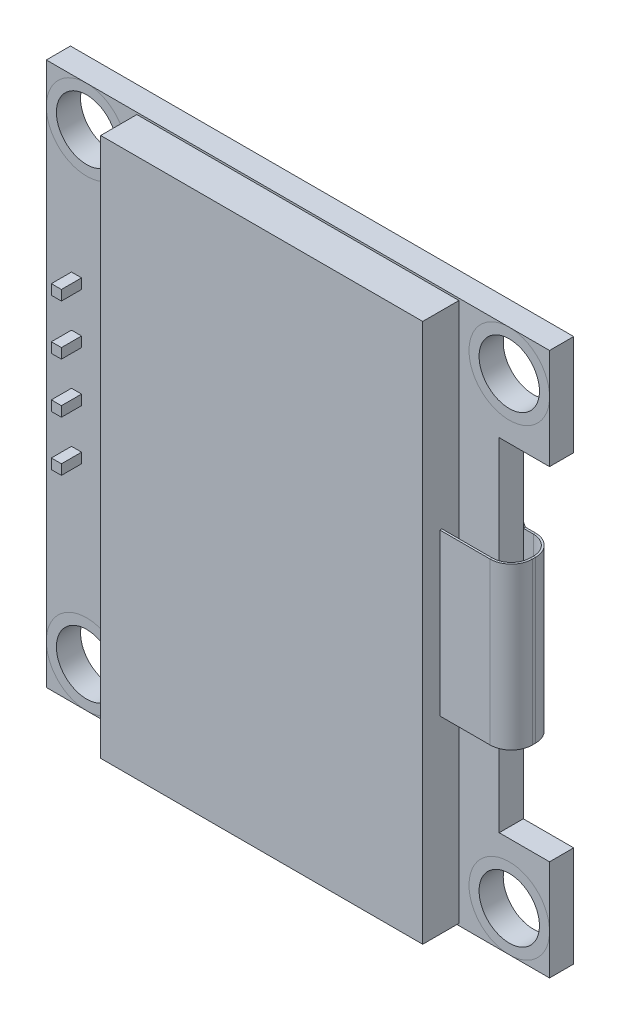
from build123d import *

# Parameters (mm, degrees)
BOSS_EXTRUDE1_DEPTH      = 1.2
SKETCH2_R                = 1.5
CUT_EXTRUDE1_DEPTH       = 19.437461864
BOSS_EXTRUDE2_DEPTH      = 2.5
BOSS_EXTRUDE3_DEPTH      = 5.5
BOSS_EXTRUDE3_DEPTH_BACK = 4.7
SKETCH6_W                = 0.5
SKETCH6_H                = 0.5
SKETCH7_W                = 16
SKETCH7_H                = 26.8
BOSS_EXTRUDE4_DEPTH      = 1.8
SKETCH8_W                = 1.5
SKETCH8_H                = 0.75
SKETCH8_W_2              = 0.75
SKETCH8_H_2              = 1.5
BOSS_EXTRUDE5_DEPTH      = 0.8
SKETCH10_W               = 0.1
SKETCH10_H               = 8
BOSS_EXTRUDE6_DEPTH      = 0.1
SKETCH12_W               = 1
SKETCH12_H               = 22.2
BOSS_EXTRUDE7_DEPTH      = 0.06


with BuildPart() as part:
    # Sketch1 → Boss-Extrude1 (new body)
    with BuildSketch(Plane.XY):
        Polygon((10, -8.5), (10, 8.5), (12.5, 8.5), (12.5, 13.5), (-12.5, 13.5), (-12.5, -13.5), (12.5, -13.5), (12.5, -8.5), align=None)
    extrude(amount=BOSS_EXTRUDE1_DEPTH)

    # Sketch2 → Cut-Extrude1 (cut, through all)
    with BuildSketch(Plane.XY.offset(1.2)):
        with Locations((10.5, 11.5)):
            Circle(SKETCH2_R)
        with Locations(Location((10.5, -11.5, 0), (0, 0, 180))):
            Circle(SKETCH2_R)
        with Locations(Location((-10.5, 11.5, 0), (0, 0, 180))):
            Circle(SKETCH2_R)
        with Locations((-10.5, -11.5)):
            Circle(SKETCH2_R)
    extrude(amount=-CUT_EXTRUDE1_DEPTH, mode=Mode.SUBTRACT)

    # Sketch5 → Boss-Extrude2 (add)
    with BuildSketch(Plane(origin=(0, 0, 0), x_dir=(-1, 0, 0), z_dir=(0, 0, -1))):
        with BuildLine():
            Line((12.05, 6), (9.95, 6))
            ThreePointArc((9.95, 6), (9.808578644, 5.941421356), (9.75, 5.8))
            Line((9.75, 5.8), (9.75, 3.7))
            ThreePointArc((9.75, 3.7), (9.808578644, 3.558578644), (9.95, 3.5))
            ThreePointArc((9.95, 3.5), (9.808578644, 3.441421356), (9.75, 3.3))
            Line((9.75, 3.3), (9.75, 1.2))
            ThreePointArc((9.75, 1.2), (9.808578644, 1.058578644), (9.95, 1))
            ThreePointArc((9.95, 1), (9.808578644, 0.941421356), (9.75, 0.8))
            Line((9.75, 0.8), (9.75, -1.3))
            ThreePointArc((9.75, -1.3), (9.808578644, -1.441421356), (9.95, -1.5))
            ThreePointArc((9.95, -1.5), (9.808578644, -1.558578644), (9.75, -1.7))
            Line((9.75, -1.7), (9.75, -3.8))
            ThreePointArc((9.75, -3.8), (9.808578644, -3.941421356), (9.95, -4))
            Line((9.95, -4), (12.05, -4))
            ThreePointArc((12.05, -4), (12.191421356, -3.941421356), (12.25, -3.8))
            Line((12.25, -3.8), (12.25, -1.7))
            ThreePointArc((12.25, -1.7), (12.191421356, -1.558578644), (12.05, -1.5))
            ThreePointArc((12.05, -1.5), (12.191421356, -1.441421356), (12.25, -1.3))
            Line((12.25, -1.3), (12.25, 0.8))
            ThreePointArc((12.25, 0.8), (12.191421356, 0.941421356), (12.05, 1))
            ThreePointArc((12.05, 1), (12.191421356, 1.058578644), (12.25, 1.2))
            Line((12.25, 1.2), (12.25, 3.3))
            ThreePointArc((12.25, 3.3), (12.191421356, 3.441421356), (12.05, 3.5))
            ThreePointArc((12.05, 3.5), (12.191421356, 3.558578644), (12.25, 3.7))
            Line((12.25, 3.7), (12.25, 5.8))
            ThreePointArc((12.25, 5.8), (12.191421356, 5.941421356), (12.05, 6))
        make_face()
    extrude(amount=BOSS_EXTRUDE2_DEPTH)

    # Sketch6 → Boss-Extrude3 (add, two sides: drawn at the far end of the back side and taken through both)
    with BuildSketch(Plane(origin=(0, 0, -2.5), x_dir=(-1, 0, 0), z_dir=(0, 0, -1)).offset(-BOSS_EXTRUDE3_DEPTH_BACK)):
        with Locations((11, 4.75)):
            Rectangle(SKETCH6_W, SKETCH6_H)
        with Locations((11, 2.25)):
            Rectangle(SKETCH6_W, SKETCH6_H)
        with Locations((11, -0.25)):
            Rectangle(SKETCH6_W, SKETCH6_H)
        with Locations((11, -2.75)):
            Rectangle(SKETCH6_W, SKETCH6_H)
    extrude(amount=BOSS_EXTRUDE3_DEPTH + BOSS_EXTRUDE3_DEPTH_BACK)

    # Sketch7 → Boss-Extrude4 (add)
    with BuildSketch(Plane.XY.offset(1.2)):
        Rectangle(SKETCH7_W, SKETCH7_H)
    extrude(amount=BOSS_EXTRUDE4_DEPTH)

    # Sketch8 → Boss-Extrude5 (add)
    with BuildSketch(Plane(origin=(0, 0, 0), x_dir=(-1, 0, 0), z_dir=(0, 0, -1))):
        with Locations((0.75, 12.125)):
            Rectangle(SKETCH8_W, SKETCH8_H)
        with Locations((0.75, 9.402777778)):
            Rectangle(SKETCH8_W, SKETCH8_H)
        with Locations((0.75, 6.680555556)):
            Rectangle(SKETCH8_W, SKETCH8_H)
        with Locations((0.75, 3.958333333)):
            Rectangle(SKETCH8_W, SKETCH8_H)
        with Locations((0.75, 1.236111111)):
            Rectangle(SKETCH8_W, SKETCH8_H)
        with Locations((0.75, -1.486111111)):
            Rectangle(SKETCH8_W, SKETCH8_H)
        with Locations((0.75, -4.208333333)):
            Rectangle(SKETCH8_W, SKETCH8_H)
        with Locations((0.75, -6.930555556)):
            Rectangle(SKETCH8_W, SKETCH8_H)
        with Locations((0.75, -9.652777778)):
            Rectangle(SKETCH8_W, SKETCH8_H)
        with Locations((0.75, -12.375)):
            Rectangle(SKETCH8_W, SKETCH8_H)
        with Locations((-2.375, -9.75)):
            Rectangle(SKETCH8_W_2, SKETCH8_H_2)
        with Locations((-4.125, -9.75)):
            Rectangle(SKETCH8_W_2, SKETCH8_H_2)
        with Locations((-2.375, 9.75)):
            Rectangle(SKETCH8_W_2, SKETCH8_H_2)
        with Locations((-4.125, 9.75)):
            Rectangle(SKETCH8_W_2, SKETCH8_H_2)
    extrude(amount=BOSS_EXTRUDE5_DEPTH)

    # Sweep1: sweep along a path in Sketch9
    with BuildLine(Plane(origin=(0, 13.5, 0), x_dir=(1, 0, 0), z_dir=(0, 1, 0))) as sweep1_path:
        Line((8, -2.1), (10.5, -2.1))
        ThreePointArc((10.5, -2.1), (11.207106781, -1.807106781), (11.5, -1.1))
        Line((11.5, -1.1), (11.5, -0.95))
        ThreePointArc((11.5, -0.95), (11.207106781, -0.242893219), (10.5, 0.05))
        Line((10.5, 0.05), (9, 0.05))
    # Sketch10 → Sweep1 (sweep)
    with BuildSketch(Plane(origin=(8, 0, 0), x_dir=(0, 0, -1), z_dir=(1, 0, 0))):
        with Locations((-2.1, 0)):
            Rectangle(SKETCH10_W, SKETCH10_H)
    sweep(path=sweep1_path.line)

    # Sketch11 → Boss-Extrude6 (add)
    with BuildSketch(Plane(origin=(0, 0, 0), x_dir=(-1, 0, 0), z_dir=(0, 0, -1))):
        Polygon((-6.5, -11.1), (-6.5, 11.1), (-6.572413793, 11.1), (-10, 4), (-9, 4), (-9, -4), (-10, -4), (-6.572413793, -11.1), align=None)
    extrude(amount=BOSS_EXTRUDE6_DEPTH)

    # Sketch12 → Boss-Extrude7 (add)
    with BuildSketch(Plane(origin=(0, 0, 0), x_dir=(-1, 0, 0), z_dir=(0, 0, -1))):
        with Locations((-6, 0)):
            Rectangle(SKETCH12_W, SKETCH12_H)
    extrude(amount=BOSS_EXTRUDE7_DEPTH)


solid = part.part
